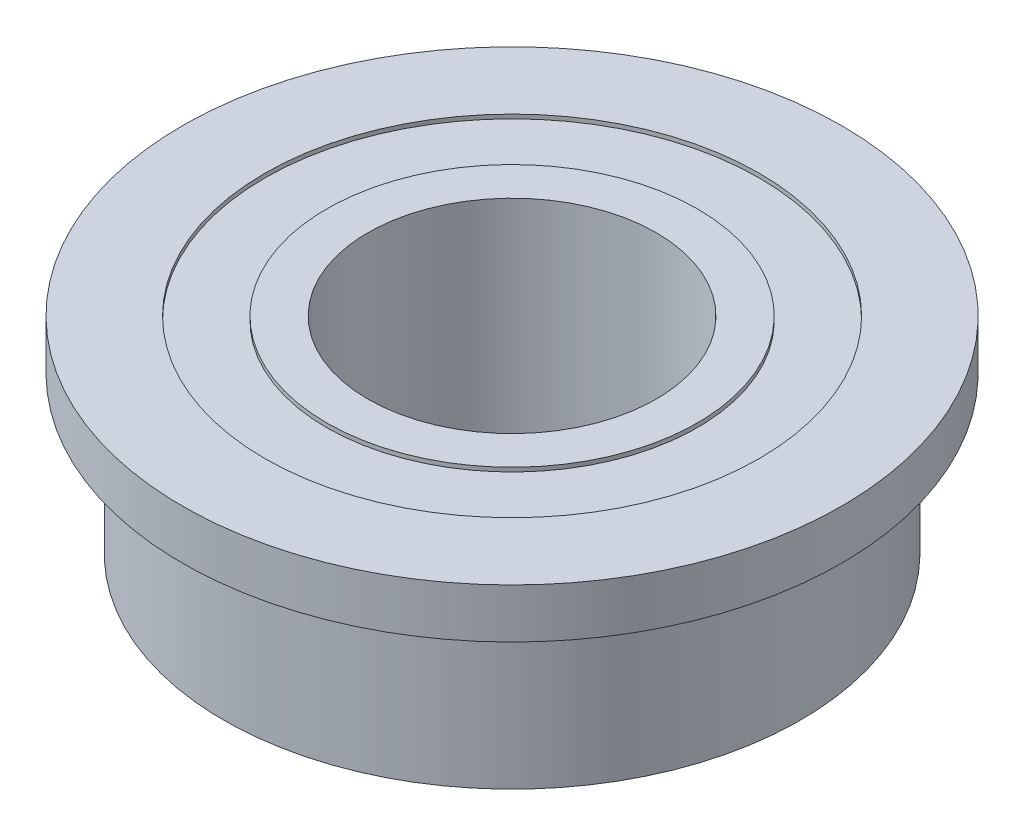
from build123d import *

# Parameters (mm, degrees)
SKETCH_2_R          = 6
SKETCH_2_R_2        = 4.5
CUT_EXTRUDE_1_DEPTH = 0.1
SKETCH_3_R          = 6
SKETCH_3_R_2        = 4.5
CUT_EXTRUDE_2_DEPTH = 0.1


with BuildPart() as part:
    # 草图1 → 旋转1 (revolve)
    with BuildSketch(Plane.XY, mode=Mode.PRIVATE) as revolve_1_sk:
        Polygon((3.5, 0), (3.5, 5), (8, 5), (8, 3.8), (7, 3.8), (7, 0), align=None)
    revolve(revolve_1_sk.sketch.rotate(Axis((0, 0, 0), (0, 1, 0)), 90), axis=Axis((0, 0, 0), (0, 1, 0)))

    # 草图2 → 切除-拉伸1 (cut, symmetric)
    with BuildSketch(Plane.XZ):
        with Locations(Location((0, 0, 0), (0, 0, 270))):
            Circle(SKETCH_2_R)
        with Locations(Location((0, 0, 0), (0, 0, 270))):
            Circle(SKETCH_2_R_2, mode=Mode.SUBTRACT)
    extrude(amount=CUT_EXTRUDE_1_DEPTH, both=True, mode=Mode.SUBTRACT)

    # 草图3 → 切除-拉伸2 (cut, symmetric)
    with BuildSketch(Plane(origin=(0, 5, 0), x_dir=(1, 0, 0), z_dir=(0, 1, 0))):
        with Locations(Location((0, 0, 0), (0, 0, 90))):
            Circle(SKETCH_3_R)
        with Locations(Location((0, 0, 0), (0, 0, 90))):
            Circle(SKETCH_3_R_2, mode=Mode.SUBTRACT)
    extrude(amount=CUT_EXTRUDE_2_DEPTH, both=True, mode=Mode.SUBTRACT)


solid = part.part
